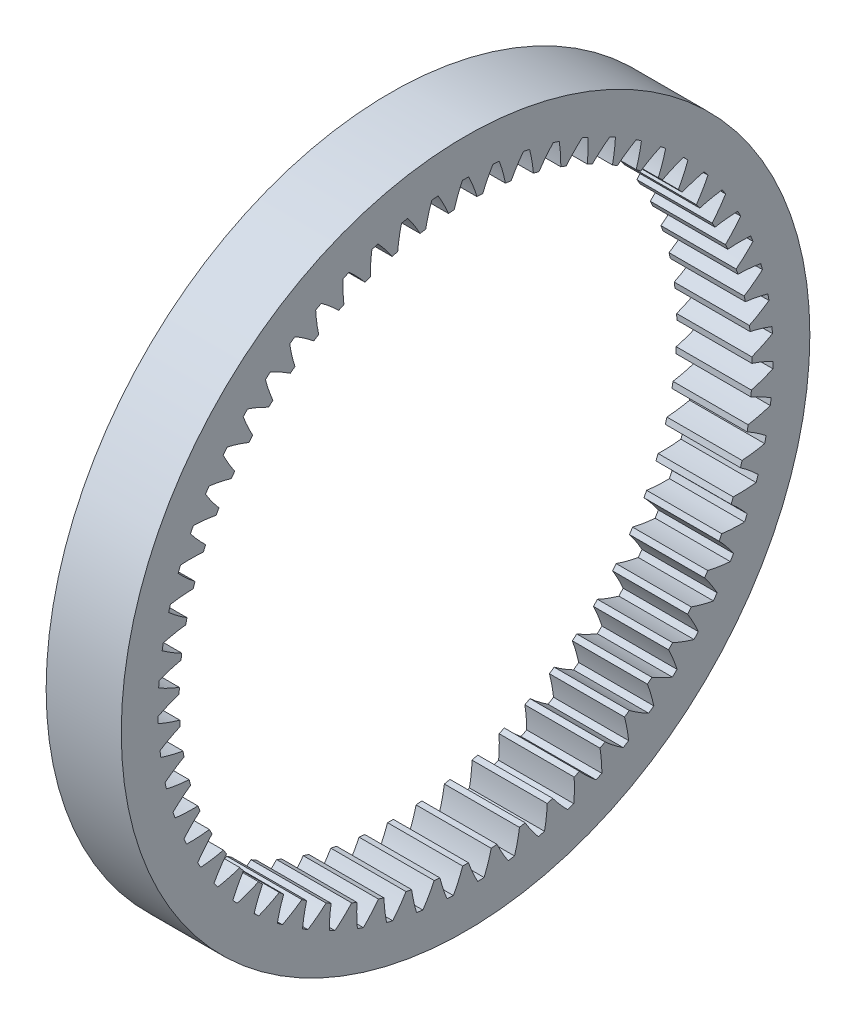
from build123d import *

# Parameters (mm, degrees)
BASPROSKE_W     = 12
BASPROSKE_H     = 9.25
TOOTHCUT_DEPTH  = 79.70196948
TEETHCUTS_COUNT = 63
TEETHCUTS_ANGLE = 354.285714286


with BuildPart() as part:
    # BasProSke → Base-Revolve (revolve)
    with BuildSketch(Plane(origin=(0, 0, 0), x_dir=(1, 0, 0), z_dir=(0, 1, 0)), mode=Mode.PRIVATE) as base_revolve_sk:
        with Locations((6, 50.375)):
            Rectangle(BASPROSKE_W, BASPROSKE_H)
    revolve(base_revolve_sk.sketch.rotate(Axis((-10, 0, 0), (1, 0, 0)), 180), axis=Axis((-10, 0, 0), (1, 0, 0)))

    # TooCutSke → ToothCut (cut, through all)
    with BuildSketch(Plane(origin=(0, 0, 0), x_dir=(0, 0, -1), z_dir=(1, 0, 0))):
        with BuildLine():
            ThreePointArc((1.826782425, 45.688093757), (1.234952625, 47.431416657), (0.509169817, 49.123361266))
            ThreePointArc((0.509169817, 49.123361266), (0, 49.126), (-0.509169817, 49.123361266))
            ThreePointArc((-0.509169817, 49.123361266), (-1.234952625, 47.431416657), (-1.826782425, 45.688093757))
            ThreePointArc((-1.826782425, 45.688093757), (0, 45.7246), (1.826782425, 45.688093757))
        make_face()
    toothcut = extrude(amount=TOOTHCUT_DEPTH, mode=Mode.SUBTRACT)

    # TeethCuts: ToothCut ×63 about axis
    teethcuts_axis = Axis((-10, 0, 0), (1, 0, 0))
    for i in range(1, TEETHCUTS_COUNT):
        add(toothcut.rotate(teethcuts_axis, i * TEETHCUTS_ANGLE / (TEETHCUTS_COUNT - 1)), mode=Mode.SUBTRACT)


solid = part.part
